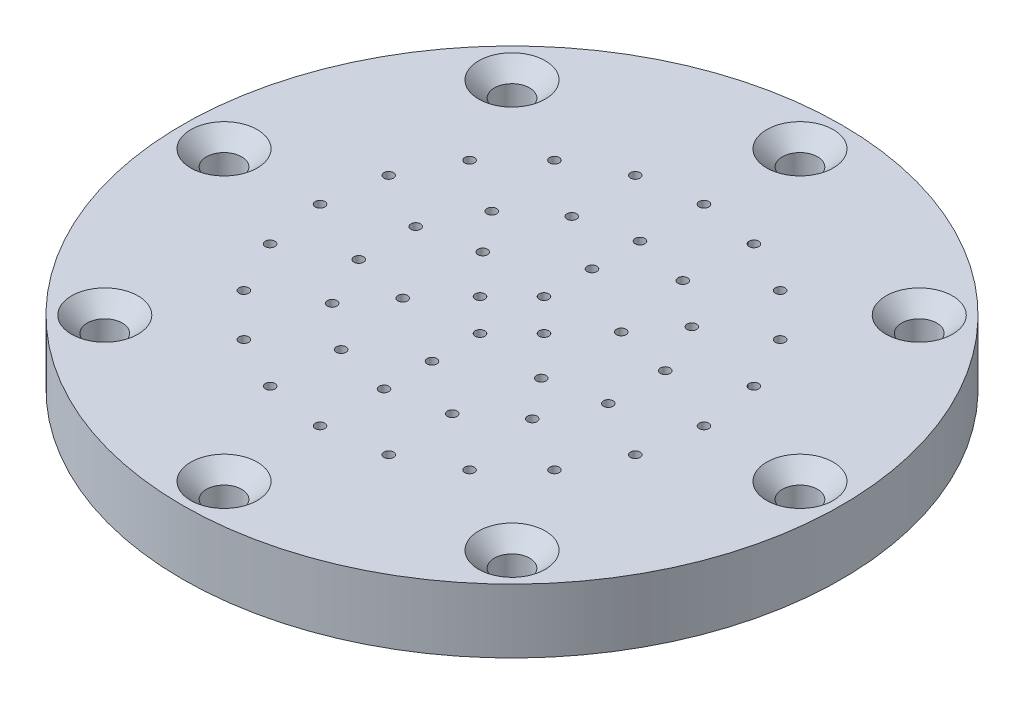
from build123d import *

# Parameters (mm, degrees)
SKETCH1_R                                       = 51.5
BOSS_EXTRUDE1_DEPTH                             = 10
CSK_FOR_M5_FLAT_HEAD_MACHINE_SCREW1_D           = 5.5
CSK_FOR_M5_FLAT_HEAD_MACHINE_SCREW1_CSINK_D     = 10.4
CSK_FOR_M5_FLAT_HEAD_MACHINE_SCREW1_CSINK_ANGLE = 90
CIRPATTERN1_COUNT                               = 8
F_1_5_1_5_DIAMETER_HOLE9_D                      = 1.5
F_1_5_1_5_DIAMETER_HOLE4_D                      = 1.5
F_1_5_1_5_DIAMETER_HOLE5_D                      = 1.5
F_1_5_1_5_DIAMETER_HOLE8_D                      = 1.5
CIRPATTERN2_COUNT                               = 20
CIRPATTERN3_COUNT                               = 14
CIRPATTERN7_COUNT                               = 6
CIRPATTERN8_COUNT                               = 4


with BuildPart() as part:
    # Sketch1 → Boss-Extrude1 (new body)
    with BuildSketch(Plane(origin=(0, 0, 0), x_dir=(1, 0, 0), z_dir=(0, 1, 0))):
        Circle(SKETCH1_R)
    extrude(amount=-BOSS_EXTRUDE1_DEPTH)

    # CSK for M5 Flat Head Machine Screw1 (through all)
    with Locations(Plane(origin=(0, 0, 0), x_dir=(1, 0, 0), z_dir=(0, 1, 0))):
        with Locations((0, 45)):
            csk_for_m5_flat_head_machine_screw1 = CounterSinkHole(CSK_FOR_M5_FLAT_HEAD_MACHINE_SCREW1_D / 2, CSK_FOR_M5_FLAT_HEAD_MACHINE_SCREW1_CSINK_D / 2, counter_sink_angle=CSK_FOR_M5_FLAT_HEAD_MACHINE_SCREW1_CSINK_ANGLE)

    # CirPattern1: CSK for M5 Flat Head Machine Screw1 ×8 about axis
    cirpattern1_axis = Axis((0, -10, 0), (0, 1, 0))
    for i in range(1, CIRPATTERN1_COUNT):
        add(csk_for_m5_flat_head_machine_screw1.rotate(cirpattern1_axis, i * 360 / CIRPATTERN1_COUNT), mode=Mode.SUBTRACT)

    # Ø1.5 (1.5) Diameter Hole9 (through all)
    with Locations(Plane(origin=(0, -10, 0), x_dir=(-1, 0, 0), z_dir=(0, -1, 0))):
        with Locations((0, 5)):
            f_1_5_1_5_diameter_hole9 = Hole(F_1_5_1_5_DIAMETER_HOLE9_D / 2)

    # Ø1.5 (1.5) Diameter Hole4 (through all)
    with Locations(Plane(origin=(0, 0, 0), x_dir=(1, 0, 0), z_dir=(0, 1, 0))):
        with Locations((0, 20)):
            f_1_5_1_5_diameter_hole4 = Hole(F_1_5_1_5_DIAMETER_HOLE4_D / 2)

    # Ø1.5 (1.5) Diameter Hole5 (through all)
    with Locations(Plane(origin=(0, 0, 0), x_dir=(1, 0, 0), z_dir=(0, 1, 0))):
        with Locations((0, 30)):
            f_1_5_1_5_diameter_hole5 = Hole(F_1_5_1_5_DIAMETER_HOLE5_D / 2)

    # Ø1.5 (1.5) Diameter Hole8 (through all)
    with Locations(Plane(origin=(0, 0, 0), x_dir=(1, 0, 0), z_dir=(0, 1, 0))):
        with Locations((0, 12.5)):
            f_1_5_1_5_diameter_hole8 = Hole(F_1_5_1_5_DIAMETER_HOLE8_D / 2)

    # CirPattern2: Ø1.5 (1.5) Diameter Hole5 ×20 about axis
    cirpattern2_axis = Axis((0, -10, 0), (0, 1, 0))
    for i in range(1, CIRPATTERN2_COUNT):
        add(f_1_5_1_5_diameter_hole5.rotate(cirpattern2_axis, i * 360 / CIRPATTERN2_COUNT), mode=Mode.SUBTRACT)

    # CirPattern3: Ø1.5 (1.5) Diameter Hole4 ×14 about axis
    cirpattern3_axis = Axis((0, -10, 0), (0, 1, 0))
    for i in range(1, CIRPATTERN3_COUNT):
        add(f_1_5_1_5_diameter_hole4.rotate(cirpattern3_axis, i * 360 / CIRPATTERN3_COUNT), mode=Mode.SUBTRACT)

    # CirPattern7: Ø1.5 (1.5) Diameter Hole8 ×6 about axis
    cirpattern7_axis = Axis((0, -10, 0), (0, 1, 0))
    for i in range(1, CIRPATTERN7_COUNT):
        add(f_1_5_1_5_diameter_hole8.rotate(cirpattern7_axis, i * 360 / CIRPATTERN7_COUNT), mode=Mode.SUBTRACT)

    # CirPattern8: Ø1.5 (1.5) Diameter Hole9 ×4 about axis
    cirpattern8_axis = Axis((0, -10, 0), (0, 1, 0))
    for i in range(1, CIRPATTERN8_COUNT):
        add(f_1_5_1_5_diameter_hole9.rotate(cirpattern8_axis, i * 360 / CIRPATTERN8_COUNT), mode=Mode.SUBTRACT)


solid = part.part
